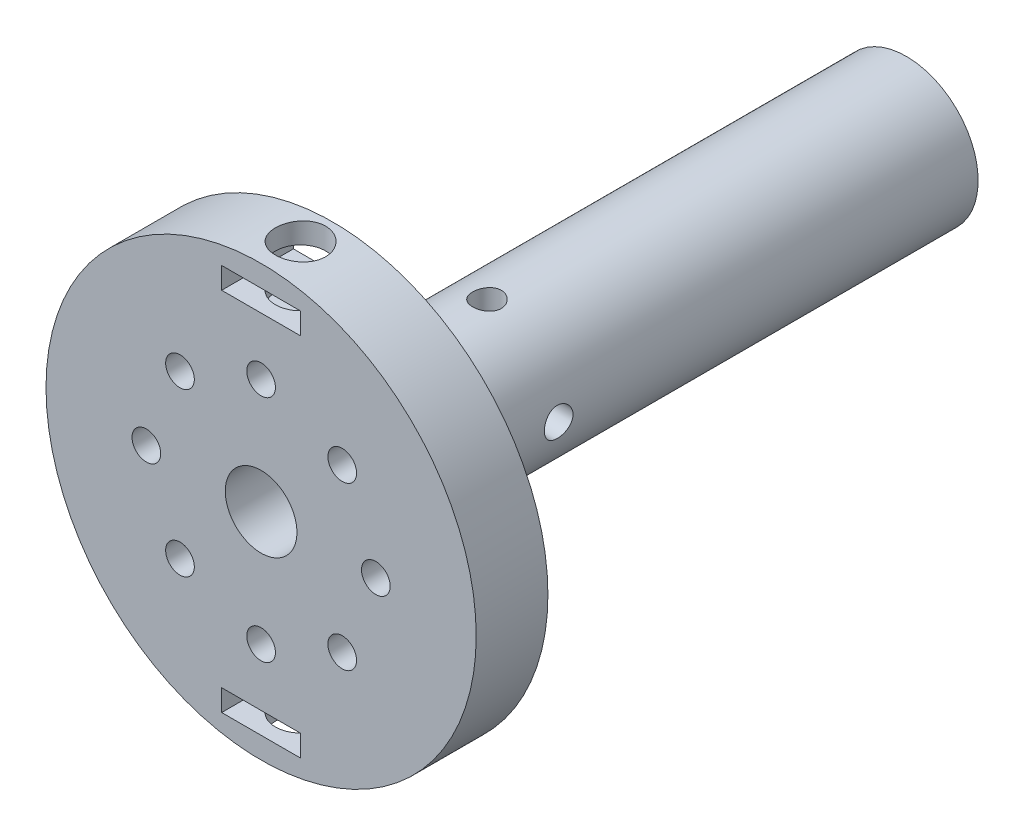
from build123d import *

# Parameters (mm, degrees)
SKETCH1_R               = 30
BOSS_EXTRUDE1_DEPTH     = 10
SKETCH2_R               = 10
BOSS_EXTRUDE2_DEPTH     = 80
SKETCH2_2_R             = 10
BOSS_EXTRUDE3_DEPTH     = 20
SKETCH5_R               = 5
CUT_EXTRUDE1_DEPTH      = 100.498743711
SKETCH6_R               = 2
CUT_EXTRUDE2_DEPTH      = 91.553851381
CIRPATTERN1_COUNT       = 2
CIRPATTERN1_ANGLE       = 90
CUT_EXTRUDE3_DEPTH      = 100.498743801
CUT_EXTRUDE3_DEPTH_BACK = 100.498743801
SKETCH7_R               = 2
SKETCH9_W               = 11
SKETCH9_H               = 3
CUT_EXTRUDE5_DEPTH      = 10
SKETCH10_R              = 3.5
CUT_EXTRUDE6_DEPTH      = 8
SKETCH17_R              = 7.355644599
BOSS_EXTRUDE4_DEPTH     = 25
SKETCH18_R              = 2
CUT_EXTRUDE7_DEPTH      = 10


with BuildPart() as part:
    # Sketch1 → Boss-Extrude1 (new body)
    with BuildSketch(Plane.XY):
        Circle(SKETCH1_R)
    extrude(amount=BOSS_EXTRUDE1_DEPTH)

    # Sketch2 → Boss-Extrude2 (add)
    with BuildSketch(Plane(origin=(0, 0, 0), x_dir=(-1, 0, 0), z_dir=(0, 0, -1))):
        Circle(SKETCH2_R)
    extrude(amount=BOSS_EXTRUDE2_DEPTH)

    # Sketch2<2> → Boss-Extrude3 (add)
    with BuildSketch(Plane(origin=(0, 0, 0), x_dir=(-1, 0, 0), z_dir=(0, 0, -1))):
        Circle(SKETCH2_2_R)
    extrude(amount=BOSS_EXTRUDE3_DEPTH)

    # Sketch5 → Cut-Extrude1 (cut, through all)
    with BuildSketch(Plane(origin=(0, 0, -80), x_dir=(-1, 0, 0), z_dir=(0, 0, -1))):
        Circle(SKETCH5_R)
    extrude(amount=-CUT_EXTRUDE1_DEPTH, mode=Mode.SUBTRACT)

    # Sketch6 → Cut-Extrude2 (cut, symmetric)
    with BuildSketch(Plane(origin=(0, 0, 0), x_dir=(1, 0, 0), z_dir=(0, 1, 0))):
        with Locations((0, 21.5)):
            Circle(SKETCH6_R)
    cut_extrude2 = extrude(amount=CUT_EXTRUDE2_DEPTH, both=True, mode=Mode.SUBTRACT)

    # CirPattern1: Cut-Extrude2 ×2 about axis
    cirpattern1_axis = Axis((0, 0, -80), (0, 0, 1))
    for i in range(1, CIRPATTERN1_COUNT):
        add(cut_extrude2.rotate(cirpattern1_axis, i * CIRPATTERN1_ANGLE / (CIRPATTERN1_COUNT - 1)), mode=Mode.SUBTRACT)

    # Sketch7 → Cut-Extrude3 (cut, two sides: drawn at the far end of the back side and taken through both)
    with BuildSketch(Plane.XY.offset(10).offset(-CUT_EXTRUDE3_DEPTH_BACK)):
        with Locations((0, 16)):
            Circle(SKETCH7_R)
        with Locations((11.313708499, 11.313708499)):
            Circle(SKETCH7_R)
        with Locations((16, 0)):
            Circle(SKETCH7_R)
        with Locations((11.313708499, -11.313708499)):
            Circle(SKETCH7_R)
        with Locations((0, -16)):
            Circle(SKETCH7_R)
        with Locations((-11.313708499, -11.313708499)):
            Circle(SKETCH7_R)
        with Locations((-16, 0)):
            Circle(SKETCH7_R)
        with Locations((-11.313708499, 11.313708499)):
            Circle(SKETCH7_R)
    extrude(amount=CUT_EXTRUDE3_DEPTH + CUT_EXTRUDE3_DEPTH_BACK, mode=Mode.SUBTRACT)

    # Sketch9 → Cut-Extrude5 (cut)
    with BuildSketch(Plane(origin=(0, 0, 0), x_dir=(-1, 0, 0), z_dir=(0, 0, -1))):
        with Locations((0, 25.5)):
            Rectangle(SKETCH9_W, SKETCH9_H)
    cut_extrude5 = extrude(amount=-CUT_EXTRUDE5_DEPTH, mode=Mode.SUBTRACT)

    # Mirror1: Cut-Extrude5 across plane
    add(cut_extrude5.mirror(Plane.ZX), mode=Mode.SUBTRACT)

    # Sketch10 → Cut-Extrude6 (cut)
    with BuildSketch(Plane(origin=(0, -30, 0), x_dir=(-1, 0, 0), z_dir=(0, -1, 0))):
        with Locations((0, -4.5)):
            Circle(SKETCH10_R)
    cut_extrude6 = extrude(amount=-CUT_EXTRUDE6_DEPTH, mode=Mode.SUBTRACT)

    # Mirror2: Cut-Extrude6 across plane
    add(cut_extrude6.mirror(Plane.ZX), mode=Mode.SUBTRACT)

    # Sketch17 → Boss-Extrude4 (add)
    with BuildSketch(Plane(origin=(0, 0, -55), x_dir=(-1, 0, 0), z_dir=(0, 0, -1))):
        Circle(SKETCH17_R)
    extrude(amount=BOSS_EXTRUDE4_DEPTH)

    # Sketch18 → Cut-Extrude7 (cut)
    with BuildSketch(Plane(origin=(0, 0, -80), x_dir=(-1, 0, 0), z_dir=(0, 0, -1))):
        Circle(SKETCH18_R)
    extrude(amount=-CUT_EXTRUDE7_DEPTH, mode=Mode.SUBTRACT)


solid = part.part
